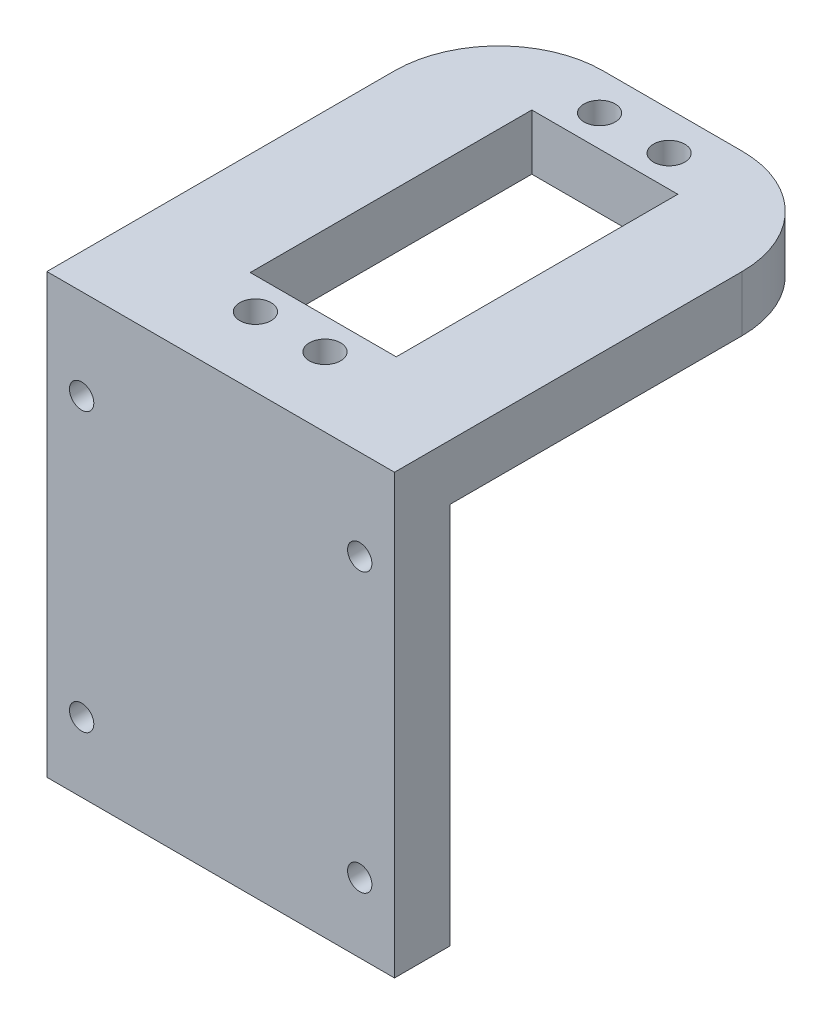
from build123d import *

# Parameters (mm, degrees)
SKETCH2_W           = 50
SKETCH2_H           = 65
BOSS_EXTRUDE1_DEPTH = 8
SKETCH4_W           = 50
SKETCH4_H           = 8
BOSS_EXTRUDE2_DEPTH = 55
SKETCH6_R           = 1.75
CUT_EXTRUDE1_DEPTH  = 10
SKETCH7_R           = 3.5
CUT_EXTRUDE2_DEPTH  = 3
SKETCH9_W           = 21
SKETCH9_H           = 40.5
CUT_EXTRUDE3_DEPTH  = 10
SKETCH10_R          = 2.25
CUT_EXTRUDE4_DEPTH  = 10
FILLET1_R           = 15
FILLET2_R           = 15


with BuildPart() as part:
    # Sketch2 → Boss-Extrude1 (new body)
    with BuildSketch(Plane(origin=(0, 0, 0), x_dir=(1, 0, 0), z_dir=(0, 1, 0))):
        with Locations((0, 5)):
            Rectangle(SKETCH2_W, SKETCH2_H)
    extrude(amount=BOSS_EXTRUDE1_DEPTH)

    # Sketch4 → Boss-Extrude2 (add)
    with BuildSketch(Plane(origin=(0, 0, 0), x_dir=(-1, 0, 0), z_dir=(0, -1, 0))):
        with Locations((0, -23.5)):
            Rectangle(SKETCH4_W, SKETCH4_H)
    extrude(amount=BOSS_EXTRUDE2_DEPTH)

    # Sketch6 → Cut-Extrude1 (cut)
    with BuildSketch(Plane(origin=(0, 0, 19.5), x_dir=(-1, 0, 0), z_dir=(0, 0, -1))):
        with Locations((-20, -5)):
            Circle(SKETCH6_R)
        with Locations((20, -5)):
            Circle(SKETCH6_R)
        with Locations((-20, -45)):
            Circle(SKETCH6_R)
        with Locations((20, -45)):
            Circle(SKETCH6_R)
    extrude(amount=-CUT_EXTRUDE1_DEPTH, mode=Mode.SUBTRACT)

    # Sketch7 → Cut-Extrude2 (cut)
    with BuildSketch(Plane(origin=(0, 0, 19.5), x_dir=(-1, 0, 0), z_dir=(0, 0, -1))):
        with Locations((-20, -5)):
            Circle(SKETCH7_R)
        with Locations((20, -5)):
            Circle(SKETCH7_R)
        with Locations((20, -45)):
            Circle(SKETCH7_R)
        with Locations((-20, -45)):
            Circle(SKETCH7_R)
    extrude(amount=-CUT_EXTRUDE2_DEPTH, mode=Mode.SUBTRACT)

    # Sketch9 → Cut-Extrude3 (cut)
    with BuildSketch(Plane(origin=(0, 8, 0), x_dir=(1, 0, 0), z_dir=(0, 1, 0))):
        with Locations((0.25, 7.25)):
            Rectangle(SKETCH9_W, SKETCH9_H)
    extrude(amount=-CUT_EXTRUDE3_DEPTH, mode=Mode.SUBTRACT)

    # Sketch10 → Cut-Extrude4 (cut)
    with BuildSketch(Plane(origin=(0, 8, 0), x_dir=(1, 0, 0), z_dir=(0, 1, 0))):
        with Locations(Location((-5, 32, 0), (0, 0, 270))):
            Circle(SKETCH10_R)
        with Locations(Location((5, 32, 0), (0, 0, 270))):
            Circle(SKETCH10_R)
        with Locations(Location((-5, -17.5, 0), (0, 0, 270))):
            Circle(SKETCH10_R)
        with Locations(Location((5, -17.5, 0), (0, 0, 270))):
            Circle(SKETCH10_R)
    extrude(amount=-CUT_EXTRUDE4_DEPTH, mode=Mode.SUBTRACT)

    # Fillet1
    fillet1_edges = [part.edges().sort_by_distance(p)[0] for p in [
        (25, 4, -37.5),
    ]]
    fillet(fillet1_edges, radius=FILLET1_R)

    # Fillet2
    fillet2_edges = [part.edges().sort_by_distance(p)[0] for p in [
        (-25, 4, -37.5),
    ]]
    fillet(fillet2_edges, radius=FILLET2_R)


solid = part.part
